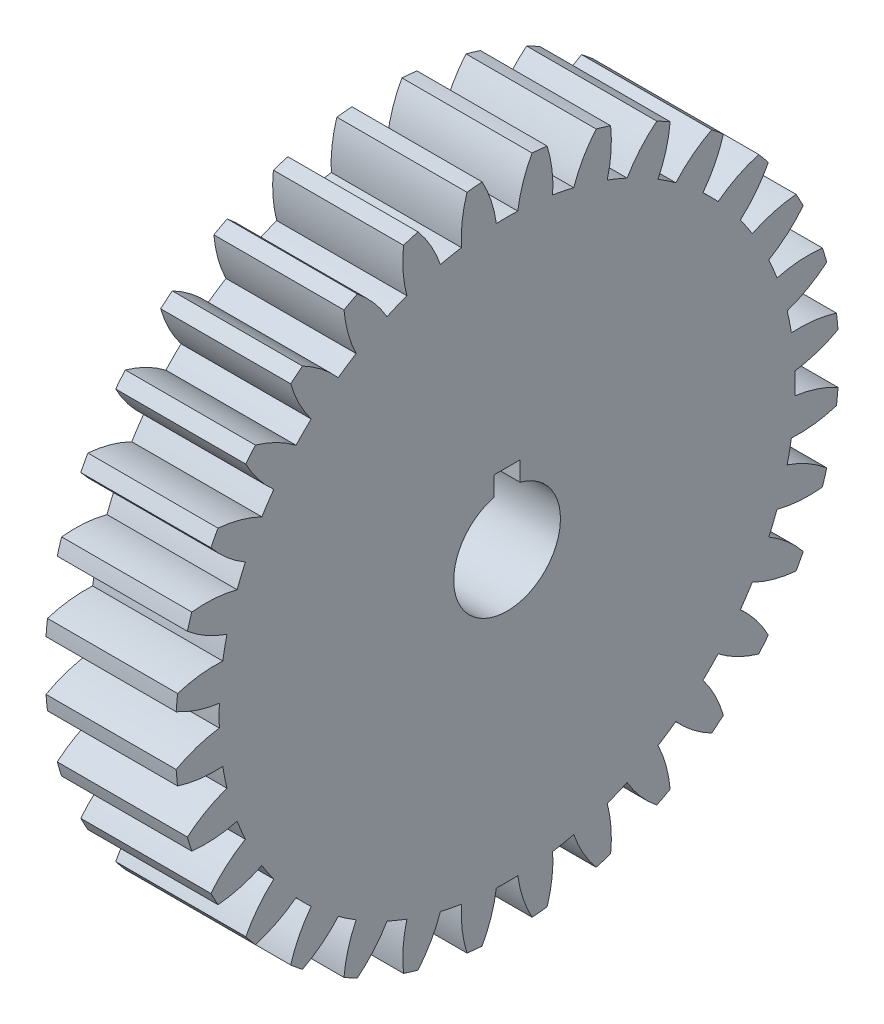
from build123d import *

# Parameters (mm, degrees)
BASPROSKE_W        = 10
BASPROSKE_H        = 25.5
TOOTHCUT_DEPTH     = 38.423254802
TEETHCUTS_COUNT    = 32
TEETHCUTS_ANGLE    = 348.75
BORSKE_R           = 3
BORE_DEPTH         = 50.0000508
KEYSKE_W           = 2
KEYSKE_H           = 4
KEYWAY_DEPTH       = 50.0000508
CUT_EXTRUDE1_DEPTH = 38.324602008


with BuildPart() as part:
    # BasProSke → Base-Revolve (revolve)
    with BuildSketch(Plane(origin=(0, 0, 0), x_dir=(1, 0, 0), z_dir=(0, 1, 0)), mode=Mode.PRIVATE) as base_revolve_sk:
        with Locations((5, 12.75)):
            Rectangle(BASPROSKE_W, BASPROSKE_H)
    revolve(base_revolve_sk.sketch.rotate(Axis((-10, 0, 0), (1, 0, 0)), 180), axis=Axis((-10, 0, 0), (1, 0, 0)))

    # TooCutSke → ToothCut (cut, through all)
    with BuildSketch(Plane(origin=(0, 0, 0), x_dir=(0, 0, -1), z_dir=(1, 0, 0))):
        with BuildLine():
            ThreePointArc((0.824824756, 22.108619136), (0, 22.124), (-0.824824756, 22.108619136))
            ThreePointArc((-0.824824756, 22.108619136), (-1.224565235, 23.831628884), (-1.933630303, 25.4520553))
            ThreePointArc((-1.933630303, 25.4520553), (0, 25.5254), (1.933630303, 25.4520553))
            ThreePointArc((1.933630303, 25.4520553), (1.224565235, 23.831628884), (0.824824756, 22.108619136))
        make_face()
    toothcut = extrude(amount=TOOTHCUT_DEPTH, mode=Mode.SUBTRACT)

    # TeethCuts: ToothCut ×32 about axis
    teethcuts_axis = Axis((-10, 0, 0), (1, 0, 0))
    for i in range(1, TEETHCUTS_COUNT):
        add(toothcut.rotate(teethcuts_axis, i * TEETHCUTS_ANGLE / (TEETHCUTS_COUNT - 1)), mode=Mode.SUBTRACT)

    # BorSke → Bore (cut, symmetric)
    with BuildSketch(Plane(origin=(0, 0, 0), x_dir=(0, 0, -1), z_dir=(1, 0, 0))):
        with Locations(Location((0, 0, 0), (0, 0, 180))):
            Circle(BORSKE_R)
    extrude(amount=BORE_DEPTH, both=True, mode=Mode.SUBTRACT)

    # KeySke → Keyway (cut, symmetric)
    with BuildSketch(Plane(origin=(0, 0, 0), x_dir=(0, 0, -1), z_dir=(1, 0, 0))):
        with Locations((0, 2)):
            Rectangle(KEYSKE_W, KEYSKE_H)
    extrude(amount=KEYWAY_DEPTH, both=True, mode=Mode.SUBTRACT)

    # Sketch1 → Cut-Extrude1 (cut, through all)
    with BuildSketch(Plane(origin=(10, 0, 0), x_dir=(0, 0, -1), z_dir=(1, 0, 0))):
        with BuildLine():
            Line((-1, 3.97617907), (-1, 5.470463517))
            Line((-1, 5.470463517), (1, 5.470463517))
            Line((1, 5.470463517), (1, 3.97617907))
            ThreePointArc((1, 3.97617907), (0, -4.1), (-1, 3.97617907))
        make_face()
    extrude(amount=-CUT_EXTRUDE1_DEPTH, mode=Mode.SUBTRACT)


solid = part.part
